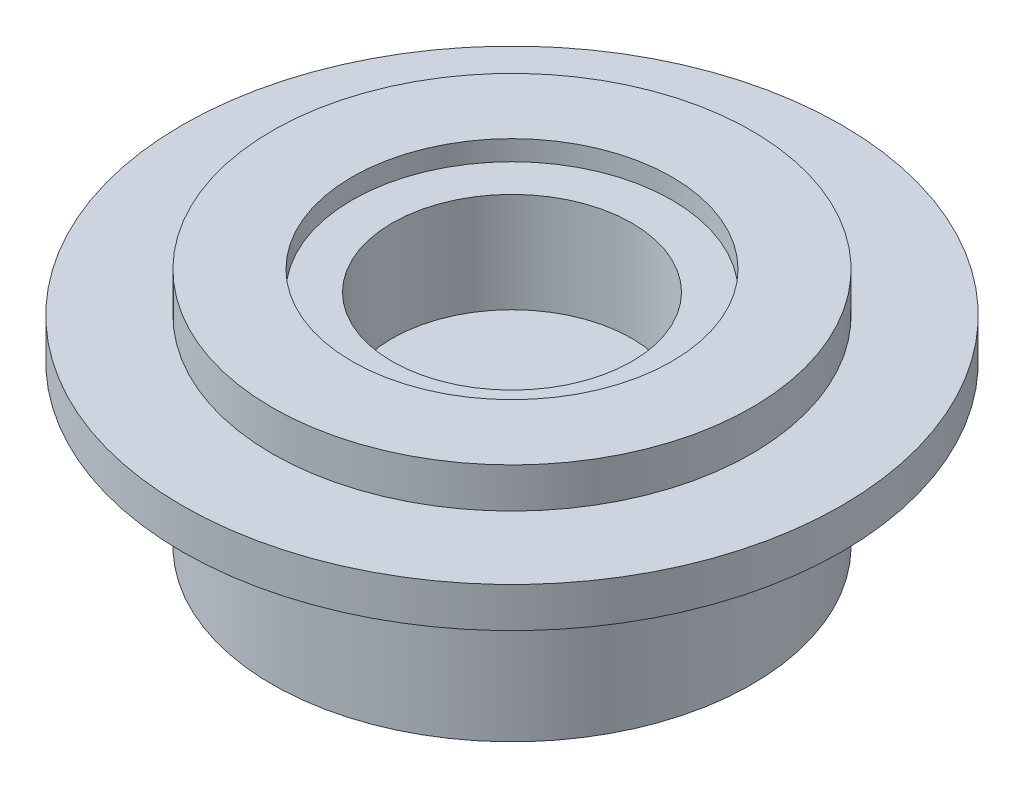
from build123d import *

# Parameters (mm, degrees)
SKETCH2_R           = 16.5
BOSS_EXTRUDE1_DEPTH = 1
SKETCH3_R           = 12
BOSS_EXTRUDE2_DEPTH = 8
BOSS_EXTRUDE3_START = 2
SKETCH4_R           = 12
BOSS_EXTRUDE3_DEPTH = 2
SKETCH5_R           = 6
CUT_EXTRUDE1_DEPTH  = 6
SKETCH6_R           = 8
CUT_EXTRUDE2_DEPTH  = 1


with BuildPart() as part:
    # Sketch2 → Boss-Extrude1 (new, symmetric)
    with BuildSketch(Plane(origin=(0, 0, 0), x_dir=(1, 0, 0), z_dir=(0, 1, 0))):
        with Locations(Location((0, 0, 0), (0, 0, 270))):
            Circle(SKETCH2_R)
    extrude(amount=BOSS_EXTRUDE1_DEPTH, both=True)

    # Sketch3 → Boss-Extrude2 (add)
    with BuildSketch(Plane.XZ.offset(1)):
        with Locations(Location((0, 0, 0), (0, 0, 270))):
            Circle(SKETCH3_R)
    extrude(amount=BOSS_EXTRUDE2_DEPTH)

    # Sketch4 → Boss-Extrude3 (add)
    with BuildSketch(Plane(origin=(0, 1, 0), x_dir=(1, 0, 0), z_dir=(0, 1, 0)).offset(BOSS_EXTRUDE3_START)):
        with Locations(Location((0, 0, 0), (0, 0, 90))):
            Circle(SKETCH4_R)
    extrude(amount=-BOSS_EXTRUDE3_DEPTH)

    # Sketch5 → Cut-Extrude1 (cut)
    with BuildSketch(Plane(origin=(0, 3, 0), x_dir=(1, 0, 0), z_dir=(0, 1, 0))):
        with Locations(Location((0, 0, 0), (0, 0, 270))):
            Circle(SKETCH5_R)
    extrude(amount=-CUT_EXTRUDE1_DEPTH, mode=Mode.SUBTRACT)

    # Sketch6 → Cut-Extrude2 (cut)
    with BuildSketch(Plane(origin=(0, 3, 0), x_dir=(1, 0, 0), z_dir=(0, 1, 0))):
        with Locations(Location((0, 0, 0), (0, 0, 270))):
            Circle(SKETCH6_R)
    extrude(amount=-CUT_EXTRUDE2_DEPTH, mode=Mode.SUBTRACT)


solid = part.part
